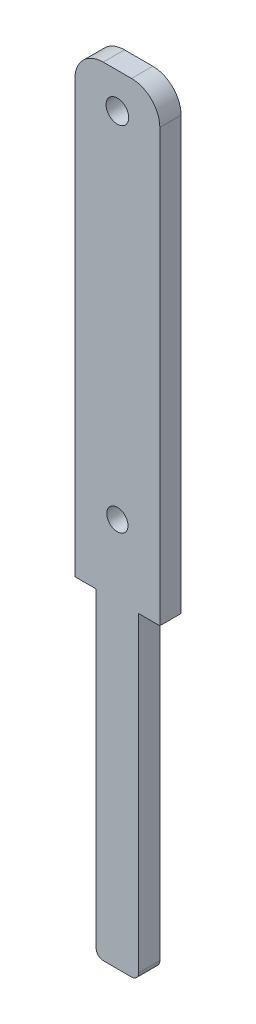
from build123d import *

# Parameters (mm, degrees)
SALIENTE_EXTRUIR1_DEPTH = 1.5
CROQUIS2_R              = 1.6
CORTAR_EXTRUIR1_DEPTH   = 3
REDONDEO1_R             = 1
CROQUIS3_R              = 1.5
CORTAR_EXTRUIR2_DEPTH   = 5


with BuildPart() as part:
    # Croquis1 → Saliente-Extruir1 (new, symmetric)
    with BuildSketch(Plane.XY):
        with BuildLine():
            Line((-6, 51), (-6, -10))
            Line((-6, -10), (-3, -10))
            Line((-3, -10), (-3, -55))
            Line((-3, -55), (3, -55))
            Line((3, -55), (3, -10))
            Line((3, -10), (6, -10))
            Line((6, -10), (6, 51))
            ThreePointArc((6, 51), (4.828427125, 53.828427125), (2, 55))
            Line((2, 55), (-2, 55))
            ThreePointArc((-2, 55), (-4.828427125, 53.828427125), (-6, 51))
        make_face()
    extrude(amount=SALIENTE_EXTRUIR1_DEPTH, both=True)

    # Croquis2 → Cortar-Extruir1 (cut)
    with BuildSketch(Plane.XY.offset(1.5)):
        with Locations((0, 50)):
            Circle(CROQUIS2_R)
    extrude(amount=-CORTAR_EXTRUIR1_DEPTH, mode=Mode.SUBTRACT)

    # Redondeo1
    redondeo1_edges = [part.edges().sort_by_distance(p)[0] for p in [
        (3, -55, 0),
        (-3, -55, 0),
    ]]
    fillet(redondeo1_edges, radius=REDONDEO1_R)

    # Croquis3 → Cortar-Extruir2 (cut, symmetric)
    with BuildSketch(Plane.XY):
        Circle(CROQUIS3_R)
    extrude(amount=CORTAR_EXTRUIR2_DEPTH, both=True, mode=Mode.SUBTRACT)


solid = part.part
